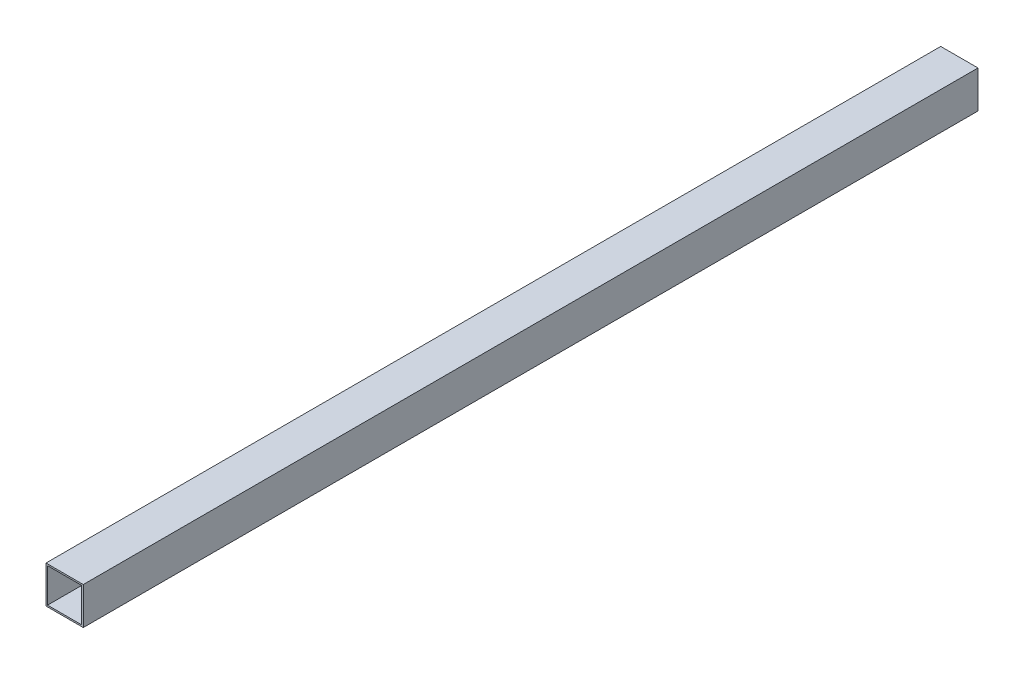
from build123d import *

# Parameters (mm, degrees)
SKETCH2_W           = 38.1
SKETCH2_H           = 38.1
SKETCH2_W_2         = 34.925
SKETCH2_H_2         = 34.925
BOSS_EXTRUDE1_DEPTH = 914.4


with BuildPart() as part:
    # Sketch2 → Boss-Extrude1 (new body)
    with BuildSketch(Plane.XY):
        with Locations((19.05, 19.05)):
            Rectangle(SKETCH2_W, SKETCH2_H)
        with Locations((19.05, 19.05)):
            Rectangle(SKETCH2_W_2, SKETCH2_H_2, mode=Mode.SUBTRACT)
    extrude(amount=BOSS_EXTRUDE1_DEPTH)


solid = part.part
